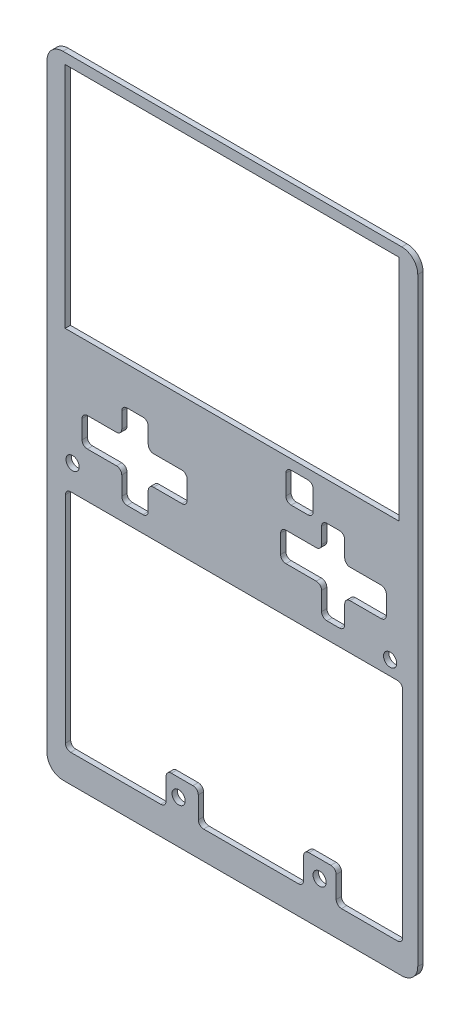
from build123d import *

# Parameters (mm, degrees)
BOSS_EXTRU_1_DEPTH      = 1
ESQUISSE2_W             = 63.121311346
ESQUISSE2_H             = 43.227445896
ENL_V_MAT_EXTRU_1_DEPTH = 1
ENL_V_MAT_EXTRU_2_DEPTH = 1
ESQUISSE4_R             = 1.25
ENL_V_MAT_EXTRU_3_DEPTH = 1


with BuildPart() as part:
    # Esquisse1 → Boss.-Extru.1 (new body)
    with BuildSketch(Plane.XY):
        with BuildLine():
            Line((-32.05, -59.71), (32.05, -59.71))
            ThreePointArc((32.05, -59.71), (34.185462479, -58.825462479), (35.07, -56.69))
            Line((35.07, -56.69), (35.07, 56.69))
            ThreePointArc((35.07, 56.69), (34.185462479, 58.825462479), (32.05, 59.71))
            Line((32.05, 59.71), (-32.05, 59.71))
            ThreePointArc((-32.05, 59.71), (-34.185462479, 58.825462479), (-35.07, 56.69))
            Line((-35.07, 56.69), (-35.07, -56.69))
            ThreePointArc((-35.07, -56.69), (-34.185462479, -58.825462479), (-32.05, -59.71))
        make_face()
    extrude(amount=BOSS_EXTRU_1_DEPTH)

    # Esquisse2 → Enlèv. mat.-Extru.1 (cut)
    with BuildSketch(Plane.XY.offset(1)):
        with Locations((-0.068131464, 36.133663017)):
            Rectangle(ESQUISSE2_W, ESQUISSE2_H)
    extrude(amount=-ENL_V_MAT_EXTRU_1_DEPTH, mode=Mode.SUBTRACT)

    # Esquisse3 → Enlèv. mat.-Extru.2 (cut)
    with BuildSketch(Plane.XY.offset(1)):
        with BuildLine():
            Line((-5.450287773, -54.403229927), (12.482160985, -54.403229927))
            ThreePointArc((12.482160985, -54.403229927), (13.189267766, -54.110336708), (13.482160985, -53.403229927))
            Line((13.482160985, -53.403229927), (13.482160985, -49.311147183))
            ThreePointArc((13.482160985, -49.311147183), (13.775054203, -48.604040402), (14.482160985, -48.311147183))
            Line((14.482160985, -48.311147183), (18.639313678, -48.311147183))
            ThreePointArc((18.639313678, -48.311147183), (19.346420459, -48.604040402), (19.639313678, -49.311147183))
            Line((19.639313678, -49.311147183), (19.639313678, -53.403229927))
            ThreePointArc((19.639313678, -53.403229927), (19.932206896, -54.110336708), (20.639313678, -54.403229927))
            Line((20.639313678, -54.403229927), (31.226680359, -54.403229927))
            ThreePointArc((31.226680359, -54.403229927), (31.93378714, -54.110336708), (32.226680359, -53.403229927))
            Line((32.226680359, -53.403229927), (32.226680359, -12.723689117))
            ThreePointArc((32.226680359, -12.723689117), (31.93378714, -12.016582336), (31.226680359, -11.723689117))
            Line((31.226680359, -11.723689117), (-30.58163263, -11.723689117))
            ThreePointArc((-30.58163263, -11.723689117), (-31.288739411, -12.016582336), (-31.58163263, -12.723689117))
            Line((-31.58163263, -12.723689117), (-31.58163263, -53.403229927))
            ThreePointArc((-31.58163263, -53.403229927), (-31.288739411, -54.110336708), (-30.58163263, -54.403229927))
            Line((-30.58163263, -54.403229927), (-13.536578839, -54.403229927))
            ThreePointArc((-13.536578839, -54.403229927), (-12.829472057, -54.110336708), (-12.536578839, -53.403229927))
            Line((-12.536578839, -53.403229927), (-12.536578839, -49.311147183))
            ThreePointArc((-12.536578839, -49.311147183), (-12.24368562, -48.604040402), (-11.536578839, -48.311147183))
            Line((-11.536578839, -48.311147183), (-7.450287773, -48.311147183))
            ThreePointArc((-7.450287773, -48.311147183), (-6.743180992, -48.604040402), (-6.450287773, -49.311147183))
            Line((-6.450287773, -49.311147183), (-6.450287773, -53.403229927))
            ThreePointArc((-6.450287773, -53.403229927), (-6.157394554, -54.110336708), (-5.450287773, -54.403229927))
        make_face()
        with BuildLine():
            Line((-14.910409974, 2.342410274), (-9.548047777, 2.342410274))
            ThreePointArc((-9.548047777, 2.342410274), (-8.840940996, 2.049517055), (-8.548047777, 1.342410274))
            Line((-8.548047777, 1.342410274), (-8.548047777, -2.145402138))
            ThreePointArc((-8.548047777, -2.145402138), (-8.840940996, -2.85250892), (-9.548047777, -3.145402138))
            Line((-9.548047777, -3.145402138), (-14.910409974, -3.145402138))
            ThreePointArc((-14.910409974, -3.145402138), (-15.617516755, -3.438295357), (-15.910409974, -4.145402138))
            Line((-15.910409974, -4.145402138), (-15.910409974, -7.633214551))
            ThreePointArc((-15.910409974, -7.633214551), (-16.203303193, -8.340321332), (-16.910409974, -8.633214551))
            Line((-16.910409974, -8.633214551), (-19.922709244, -8.633214551))
            ThreePointArc((-19.922709244, -8.633214551), (-20.629816025, -8.340321332), (-20.922709244, -7.633214551))
            Line((-20.922709244, -7.633214551), (-20.922709244, -4.145402138))
            ThreePointArc((-20.922709244, -4.145402138), (-21.215602463, -3.438295357), (-21.922709244, -3.145402138))
            Line((-21.922709244, -3.145402138), (-27.434575926, -3.145402138))
            ThreePointArc((-27.434575926, -3.145402138), (-28.141682707, -2.85250892), (-28.434575926, -2.145402138))
            Line((-28.434575926, -2.145402138), (-28.434575926, 1.342410274))
            ThreePointArc((-28.434575926, 1.342410274), (-28.141682707, 2.049517055), (-27.434575926, 2.342410274))
            Line((-27.434575926, 2.342410274), (-21.922709244, 2.342410274))
            ThreePointArc((-21.922709244, 2.342410274), (-21.215602463, 2.635303493), (-20.922709244, 3.342410274))
            Line((-20.922709244, 3.342410274), (-20.922709244, 6.336052927))
            ThreePointArc((-20.922709244, 6.336052927), (-20.629816025, 7.043159708), (-19.922709244, 7.336052927))
            Line((-19.922709244, 7.336052927), (-16.910409974, 7.336052927))
            ThreePointArc((-16.910409974, 7.336052927), (-16.203303193, 7.043159708), (-15.910409974, 6.336052927))
            Line((-15.910409974, 6.336052927), (-15.910409974, 3.342410274))
            ThreePointArc((-15.910409974, 3.342410274), (-15.617516755, 2.635303493), (-14.910409974, 2.342410274))
        make_face()
        with BuildLine():
            Line((22.256339951, 2.342410274), (28.131649076, 2.342410274))
            ThreePointArc((28.131649076, 2.342410274), (28.838755857, 2.049517055), (29.131649076, 1.342410274))
            Line((29.131649076, 1.342410274), (29.131649076, -2.145402138))
            ThreePointArc((29.131649076, -2.145402138), (28.838755857, -2.85250892), (28.131649076, -3.145402138))
            Line((28.131649076, -3.145402138), (22.256339951, -3.145402138))
            ThreePointArc((22.256339951, -3.145402138), (21.54923317, -3.438295357), (21.256339951, -4.145402138))
            Line((21.256339951, -4.145402138), (21.256339951, -7.633214551))
            ThreePointArc((21.256339951, -7.633214551), (20.963446732, -8.340321332), (20.256339951, -8.633214551))
            Line((20.256339951, -8.633214551), (17.869767116, -8.633214551))
            ThreePointArc((17.869767116, -8.633214551), (17.162660335, -8.340321332), (16.869767116, -7.633214551))
            Line((16.869767116, -7.633214551), (16.869767116, -4.145402138))
            ThreePointArc((16.869767116, -4.145402138), (16.576873898, -3.438295357), (15.869767116, -3.145402138))
            Line((15.869767116, -3.145402138), (10.124858061, -3.145402138))
            ThreePointArc((10.124858061, -3.145402138), (9.41775128, -2.85250892), (9.124858061, -2.145402138))
            Line((9.124858061, -2.145402138), (9.124858061, 1.342410274))
            ThreePointArc((9.124858061, 1.342410274), (9.41775128, 2.049517055), (10.124858061, 2.342410274))
            Line((10.124858061, 2.342410274), (15.869767116, 2.342410274))
            ThreePointArc((15.869767116, 2.342410274), (16.576873898, 2.635303493), (16.869767116, 3.342410274))
            Line((16.869767116, 3.342410274), (16.869767116, 6.336052927))
            ThreePointArc((16.869767116, 6.336052927), (17.162660335, 7.043159708), (17.869767116, 7.336052927))
            Line((17.869767116, 7.336052927), (20.256339951, 7.336052927))
            ThreePointArc((20.256339951, 7.336052927), (20.963446732, 7.043159708), (21.256339951, 6.336052927))
            Line((21.256339951, 6.336052927), (21.256339951, 3.342410274))
            ThreePointArc((21.256339951, 3.342410274), (21.54923317, 2.635303493), (22.256339951, 2.342410274))
        make_face()
        with BuildLine():
            Line((11.114053306, 12.655752766), (14.294222496, 12.655752766))
            ThreePointArc((14.294222496, 12.655752766), (15.001329278, 12.362859547), (15.294222496, 11.655752766))
            Line((15.294222496, 11.655752766), (15.294222496, 7.930302608))
            ThreePointArc((15.294222496, 7.930302608), (15.001329278, 7.223195827), (14.294222496, 6.930302608))
            Line((14.294222496, 6.930302608), (11.114053306, 6.930302608))
            ThreePointArc((11.114053306, 6.930302608), (10.406946525, 7.223195827), (10.114053306, 7.930302608))
            Line((10.114053306, 7.930302608), (10.114053306, 11.655752766))
            ThreePointArc((10.114053306, 11.655752766), (10.406946525, 12.362859547), (11.114053306, 12.655752766))
        make_face()
    extrude(amount=-ENL_V_MAT_EXTRU_2_DEPTH, mode=Mode.SUBTRACT)

    # Esquisse4 → Enlèv. mat.-Extru.3 (cut)
    with BuildSketch(Plane.XY.offset(1)):
        with Locations((-30.226, -6.858)):
            Circle(ESQUISSE4_R)
        with Locations((29.845, -9.017)):
            Circle(ESQUISSE4_R)
        with Locations((16.51, -51.562)):
            Circle(ESQUISSE4_R)
        with Locations((-10.16, -51.562)):
            Circle(ESQUISSE4_R)
    extrude(amount=-ENL_V_MAT_EXTRU_3_DEPTH, mode=Mode.SUBTRACT)


solid = part.part
